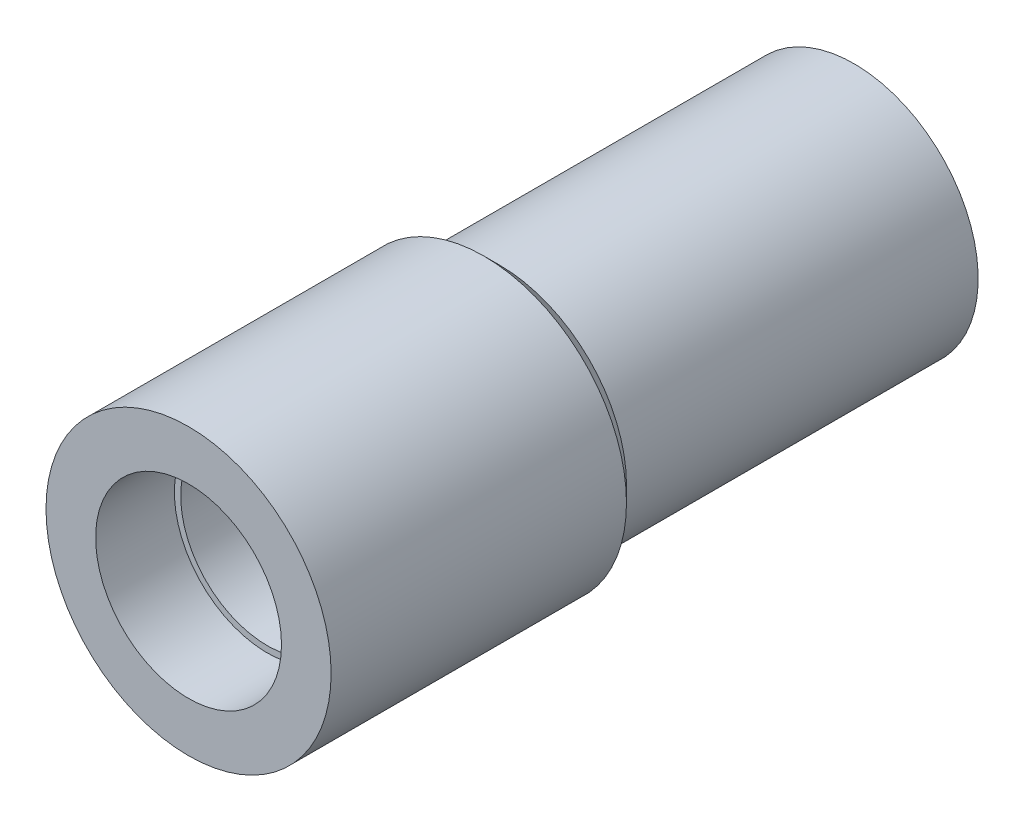
from build123d import *

# Parameters (mm, degrees)
SKETCH1_R          = 4.5974
EXTRUDE1_DEPTH     = 21.463
SKETCH3_R          = 2.794
CUT_EXTRUDE2_DEPTH = 23.426157551
SKETCH4_R          = 2.9972
CUT_EXTRUDE3_DEPTH = 2.54
SKETCH5_OUTSIDE_W  = 16.212
SKETCH5_OUTSIDE_H  = 16.212
SKETCH5_OUTSIDE_R  = 4.0005
CUT_EXTRUDE4_DEPTH = 11.43
CUT_EXTRUDE5_START = -2.54
SKETCH6_R          = 2.9972
CUT_EXTRUDE5_DEPTH = 2.54
CHAMFER1_SIZE      = 0.508


with BuildPart() as part:
    # Sketch1 → Extrude1 (new body)
    with BuildSketch(Plane.XY):
        Circle(SKETCH1_R)
    extrude(amount=EXTRUDE1_DEPTH)

    # Sketch3 → Cut-Extrude2 (cut, through all)
    with BuildSketch(Plane.XY.offset(21.463)):
        Circle(SKETCH3_R)
    extrude(amount=-CUT_EXTRUDE2_DEPTH, mode=Mode.SUBTRACT)

    # Sketch4 → Cut-Extrude3 (cut)
    with BuildSketch(Plane.XY.offset(21.463)):
        Circle(SKETCH4_R)
    extrude(amount=-CUT_EXTRUDE3_DEPTH, mode=Mode.SUBTRACT)

    # Sketch5 outside → Cut-Extrude4 (cut)
    with BuildSketch(Plane(origin=(0, 0, 0), x_dir=(-1, 0, 0), z_dir=(0, 0, -1))):
        Rectangle(SKETCH5_OUTSIDE_W, SKETCH5_OUTSIDE_H)
        Circle(SKETCH5_OUTSIDE_R, mode=Mode.SUBTRACT)
    extrude(amount=-CUT_EXTRUDE4_DEPTH, mode=Mode.SUBTRACT)

    # Sketch6 → Cut-Extrude5 (cut)
    with BuildSketch(Plane(origin=(0, 0, 0), x_dir=(-1, 0, 0), z_dir=(0, 0, -1)).offset(CUT_EXTRUDE5_START)):
        with Locations(Location((0, 0, 0), (0, 0, 180))):
            Circle(SKETCH6_R)
    extrude(amount=CUT_EXTRUDE5_DEPTH, mode=Mode.SUBTRACT)

    # Chamfer1
    chamfer1_edges = [part.edges().sort_by_distance(p)[0] for p in [
        (-4.5974, 0, 11.43),
    ]]
    chamfer(chamfer1_edges, length=CHAMFER1_SIZE)


solid = part.part
